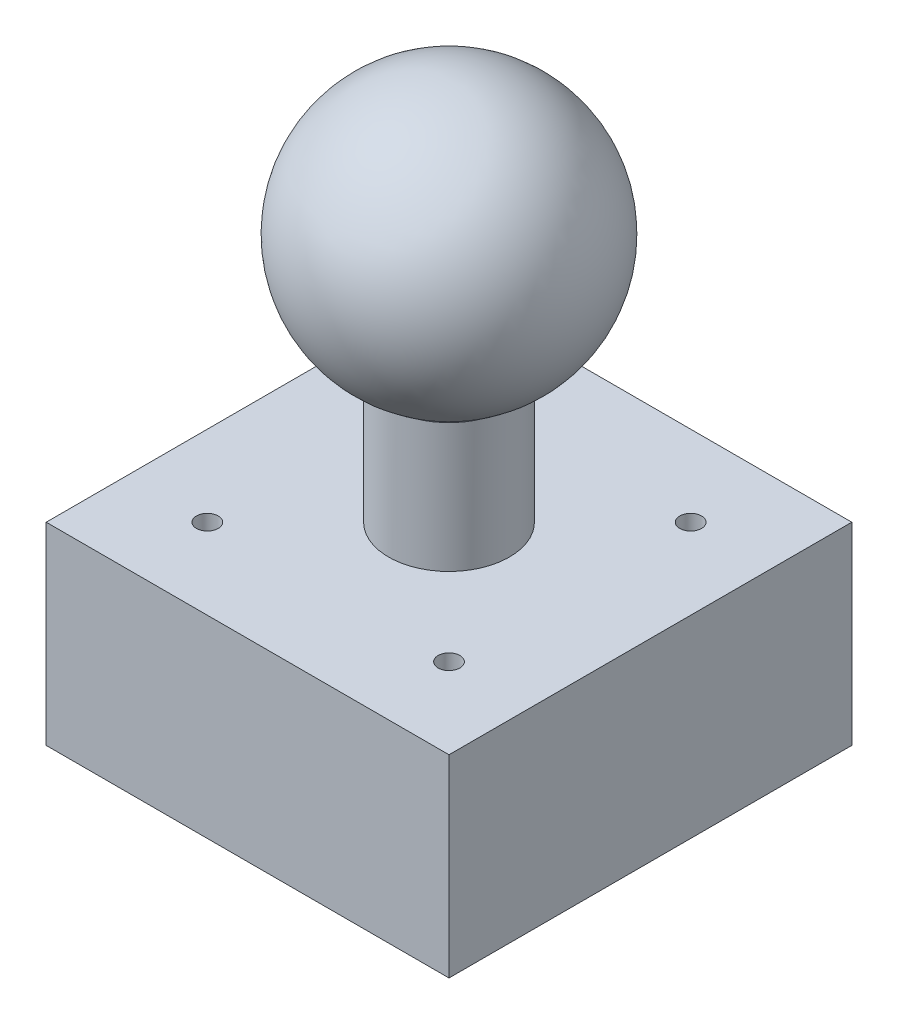
from build123d import *

# Parameters (mm, degrees)
CROQUIS1_W              = 50
CROQUIS1_H              = 50
CROQUIS1_R              = 1.35
SALIENTE_EXTRUIR1_DEPTH = 24
CROQUIS2_R              = 7.5
SALIENTE_EXTRUIR2_DEPTH = 40


with BuildPart() as part:
    # Croquis1 → Saliente-Extruir1 (new body)
    with BuildSketch(Plane(origin=(0, 0, 0), x_dir=(1, 0, 0), z_dir=(0, 1, 0))):
        Rectangle(CROQUIS1_W, CROQUIS1_H)
        with Locations(Location((-15, 15, 0), (0, 0, 270))):
            Circle(CROQUIS1_R, mode=Mode.SUBTRACT)
        with Locations(Location((15, 15, 0), (0, 0, 90))):
            Circle(CROQUIS1_R, mode=Mode.SUBTRACT)
        with Locations(Location((-15, -15, 0), (0, 0, 90))):
            Circle(CROQUIS1_R, mode=Mode.SUBTRACT)
        with Locations(Location((15, -15, 0), (0, 0, 270))):
            Circle(CROQUIS1_R, mode=Mode.SUBTRACT)
    extrude(amount=SALIENTE_EXTRUIR1_DEPTH)

    # Croquis2 → Saliente-Extruir2 (add)
    with BuildSketch(Plane(origin=(0, 0, 0), x_dir=(1, 0, 0), z_dir=(0, 1, 0))):
        with Locations(Location((0, 0, 0), (0, 0, 90))):
            Circle(CROQUIS2_R)
    extrude(amount=SALIENTE_EXTRUIR2_DEPTH)

    # Croquis3 → Revolución1 (revolve)
    with BuildSketch(Plane(origin=(0, 55, 0), x_dir=(1, 0, 0), z_dir=(0, 1, 0))):
        with BuildLine():
            Line((0, 16.5), (0, -16.5))
            ThreePointArc((0, -16.5), (16.5, 0), (0, 16.5))
        make_face()
    revolve(axis=Axis((0, 55, -16.5), (0, 0, 1)))


solid = part.part
